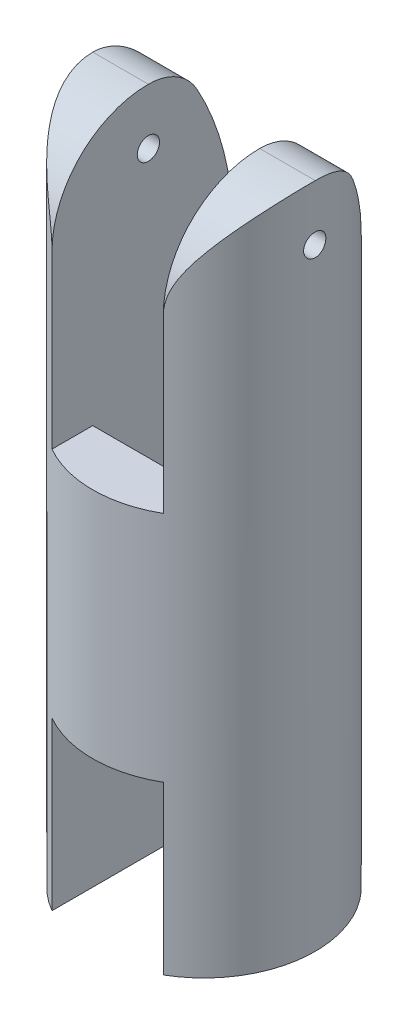
from build123d import *
from build123d.topology import SkipClean

# Parameters (mm, degrees)
BOSS_EXTRUDE1_DEPTH      = 7.5
BOSS_EXTRUDE1_DEPTH_BACK = 7.5
SKETCH1_R                = 5
BOSS_EXTRUDE3_DEPTH      = 7.5
BOSS_EXTRUDE4_START      = 7.5
BOSS_EXTRUDE4_DEPTH      = 7.5
CUT_EXTRUDE2_DEPTH       = 24.58495283
CUT_EXTRUDE2_DEPTH_BACK  = 24.58495283
SKETCH5_W                = 5
SKETCH5_H                = 5
CUT_EXTRUDE4_DEPTH       = 18.5
CUT_EXTRUDE4_DEPTH_BACK  = 7.5
SKETCH14_W               = 0.500000016
SKETCH14_H               = 2.5
CUT_EXTRUDE5_DEPTH       = 7.5
CUT_EXTRUDE5_DEPTH_BACK  = 7.5
CUT_EXTRUDE8_DEPTH       = 7.5
CUT_EXTRUDE8_DEPTH_BACK  = 7.5
SKETCH17_W               = 5
SKETCH17_H               = 4.6


with BuildPart() as part:
    # Sketch1 → Boss-Extrude1 (new, two sides: drawn at the far end of the back side and taken through both)
    with BuildSketch(Plane(origin=(0, 0, 0), x_dir=(1, 0, 0), z_dir=(0, 1, 0)).offset(-BOSS_EXTRUDE1_DEPTH_BACK)):
        Circle(SKETCH1_R)
    extrude(amount=BOSS_EXTRUDE1_DEPTH + BOSS_EXTRUDE1_DEPTH_BACK)

    # Sketch3 → Boss-Extrude3 (add)
    with SkipClean():  # the faces are left unmerged after this step: merging them gives an invalid solid
        with BuildSketch(Plane(origin=(0, 7.5, 0), x_dir=(1, 0, 0), z_dir=(0, 1, 0))):
            with BuildLine():
                Line((-2.5, 4.330127019), (-2.5, -4.330127019))
                ThreePointArc((-2.5, -4.330127019), (-5, 0), (-2.5, 4.330127019))
            make_face()
            with BuildLine():
                Line((2.5, 4.330127019), (2.5, -4.330127019))
                ThreePointArc((2.5, -4.330127019), (5, 0), (2.5, 4.330127019))
            make_face()
        extrude(amount=BOSS_EXTRUDE3_DEPTH)

    # Sketch4 → Boss-Extrude4 (add)
    with SkipClean():  # the faces are left unmerged after this step: merging them gives an invalid solid
        with BuildSketch(Plane.XZ.offset(7.5).offset(BOSS_EXTRUDE4_START)):
            with BuildLine():
                Line((-2.5, 4.330127019), (-2.5, -4.330127019))
                ThreePointArc((-2.5, -4.330127019), (-5, 0), (-2.5, 4.330127019))
            make_face()
            with BuildLine():
                Line((2.5, 4.330127019), (2.5, -4.330127019))
                ThreePointArc((2.5, -4.330127019), (5, 0), (2.5, 4.330127019))
            make_face()
        extrude(amount=-BOSS_EXTRUDE4_DEPTH)

    # Sketch5 → Cut-Extrude2 (cut, two sides: drawn at the far end of the back side and taken through both)
    with SkipClean():  # the faces are left unmerged after this step: merging them gives an invalid solid
        with BuildSketch(Plane.XZ.offset(7.5).offset(-CUT_EXTRUDE2_DEPTH_BACK)):
            Rectangle(SKETCH5_W, SKETCH5_H)
        extrude(amount=CUT_EXTRUDE2_DEPTH + CUT_EXTRUDE2_DEPTH_BACK, mode=Mode.SUBTRACT)

    # Sketch10 → Cut-Extrude4 (cut, two sides: drawn at the far end of the back side and taken through both)
    with SkipClean():  # the faces are left unmerged after this step: merging them gives an invalid solid
        with BuildSketch(Plane(origin=(-2.5, 0, 0), x_dir=(0, 0, -1), z_dir=(1, 0, 0)).offset(-CUT_EXTRUDE4_DEPTH_BACK)):
            with BuildLine():
                Line((-4.33012702, 10.66987298), (-4.331858603, 15.169872647))
                Line((-4.331858603, 15.169872647), (4.328395437, 15.169872647))
                Line((4.328395437, 15.169872647), (4.33012702, 10.66987298))
                ThreePointArc((4.33012702, 10.66987298), (0, 15), (-4.33012702, 10.66987298))
            make_face()
        extrude(amount=CUT_EXTRUDE4_DEPTH + CUT_EXTRUDE4_DEPTH_BACK, mode=Mode.SUBTRACT)


with BuildPart() as cut_extrude4_piece_1:
    # of the separate pieces the step leaves, piece 1, a body of its own (cut_extrude4_pieces)
    add(part.part.solids().sort_by_distance((5, 0, 0))[0])

    # Sketch14 → #97 (0.03937008) Diameter Hole1 (revolve, cut)
    with SkipClean():  # the faces are left unmerged after this step: merging them gives an invalid solid
        with BuildSketch(Plane(origin=(2.5, 12.5, 0), x_dir=(0, 0, 1), z_dir=(0, 1, 0))):
            with Locations((0.250000008, 1.25)):
                Rectangle(SKETCH14_W, SKETCH14_H)
        revolve(axis=Axis((-3.85, 12.5, 0), (1, 0, 0)), mode=Mode.SUBTRACT)

    # Sketch15 → #97 (0.03937008) Diameter Hole2 (revolve, cut)
    with SkipClean():  # the faces are left unmerged after this step: merging them gives an invalid solid
        with BuildSketch(Plane(origin=(2.5, 12.5, 0), x_dir=(0, 0, -1), z_dir=(0, 1, 0))):
            Polygon((0, 0), (0, 10.300430319), (0.500000016, 10), (0.500000016, 0), align=None)
        revolve(axis=Axis((8.85, 12.5, 0), (-1, 0, 0)), mode=Mode.SUBTRACT)


with BuildPart() as cut_extrude4_piece_2:
    # of the separate pieces the step leaves, piece 2, a body of its own (cut_extrude4_pieces)
    add(part.part.solids().sort_by_distance((2.502883751, 15, -4.328460803))[0])


with BuildPart() as cut_extrude4_piece_3:
    # of the separate pieces the step leaves, piece 3, a body of its own (cut_extrude4_pieces)
    add(part.part.solids().sort_by_distance((-2.5, 15, -4.330127019))[0])


with BuildPart() as cut_extrude5_tool:
    # Sketch16 → Cut-Extrude5 (new, two sides: drawn at the far end of the back side and taken through both)
    with SkipClean():  # the faces are left unmerged after this step: merging them gives an invalid solid
        with BuildSketch(Plane(origin=(-2.5, 0, 0), x_dir=(0, 0, -1), z_dir=(1, 0, 0)).offset(-CUT_EXTRUDE5_DEPTH_BACK)):
            with BuildLine():
                Line((5.450138396, 3.309889021), (7.392049741, 3.309889021))
                Line((7.392049741, 3.309889021), (7.392049741, 15))
                Line((7.392049741, 15), (0, 15))
                ThreePointArc((0, 15), (1.271548544, 14.652478641), (2.189584866, 13.70653144))
                ThreePointArc((2.189584866, 13.70653144), (3.387744198, 10.686815519), (3.795708462, 7.463799045))
                ThreePointArc((3.795708462, 7.463799045), (4.224533696, 5.228172349), (5.450138396, 3.309889021))
            make_face()
        extrude(amount=CUT_EXTRUDE5_DEPTH + CUT_EXTRUDE5_DEPTH_BACK)


with BuildPart() as cut_extrude4_piece_1_1:
    with SkipClean():  # the faces are left unmerged after this step: merging them gives an invalid solid
        add(cut_extrude4_piece_1.part)

        # Cut-Extrude5: cut by cut_extrude5_tool
        add(cut_extrude5_tool.part, mode=Mode.SUBTRACT)

    # Sketch17 → Cut-Extrude8 (cut, two sides: drawn at the far end of the back side and taken through both)
    with SkipClean():  # the faces are left unmerged after this step: merging them gives an invalid solid
        with BuildSketch(Plane.XY.offset(-CUT_EXTRUDE8_DEPTH_BACK)):
            with Locations((0, 5.263799045)):
                Rectangle(SKETCH17_W, SKETCH17_H)
        extrude(amount=CUT_EXTRUDE8_DEPTH + CUT_EXTRUDE8_DEPTH_BACK, mode=Mode.SUBTRACT)


with BuildPart() as cut_extrude4_piece_2_1:
    with SkipClean():  # the faces are left unmerged after this step: merging them gives an invalid solid
        add(cut_extrude4_piece_2.part)

        # Cut-Extrude5: cut by cut_extrude5_tool
        add(cut_extrude5_tool.part, mode=Mode.SUBTRACT)


with BuildPart() as cut_extrude4_piece_3_1:
    with SkipClean():  # the faces are left unmerged after this step: merging them gives an invalid solid
        add(cut_extrude4_piece_3.part)

        # Cut-Extrude5: cut by cut_extrude5_tool
        add(cut_extrude5_tool.part, mode=Mode.SUBTRACT)


solid = cut_extrude4_piece_1_1.part
